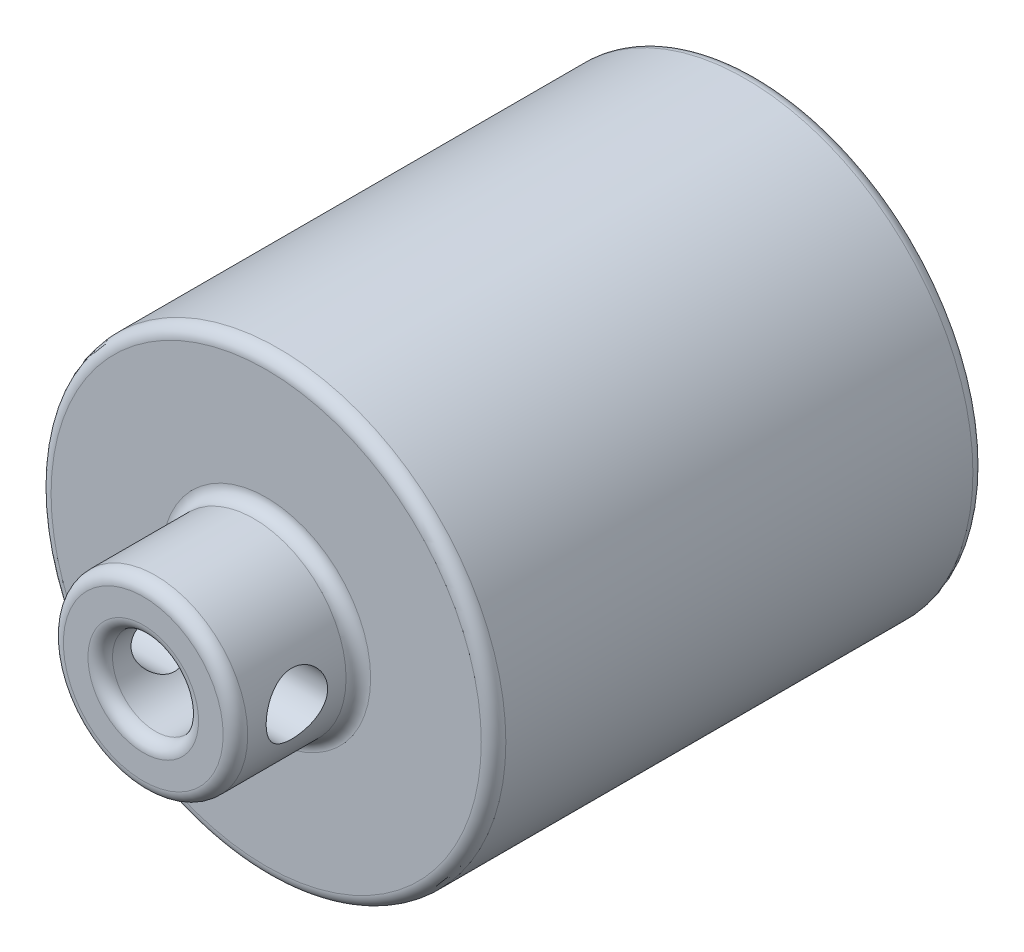
from build123d import *

# Parameters (mm, degrees)
SKETCH1_R           = 18.5
BOSS_EXTRUDE1_DEPTH = 40
SKETCH2_R           = 7.5
BOSS_EXTRUDE2_DEPTH = 10
SKETCH3_R           = 3.5
CUT_EXTRUDE1_DEPTH  = 32
FILLET1_R           = 1
FILLET2_R           = 1
FILLET3_R           = 1
FILLET4_R           = 1
FILLET6_R           = 1
SKETCH4_R           = 2.5
CUT_EXTRUDE2_DEPTH  = 141


with BuildPart() as part:
    # Sketch1 → Boss-Extrude1 (new body)
    with BuildSketch(Plane.XY):
        Circle(SKETCH1_R)
    extrude(amount=BOSS_EXTRUDE1_DEPTH)

    # Sketch2 → Boss-Extrude2 (add)
    with BuildSketch(Plane.XY.offset(40)):
        Circle(SKETCH2_R)
    extrude(amount=BOSS_EXTRUDE2_DEPTH)

    # Sketch3 → Cut-Extrude1 (cut)
    with BuildSketch(Plane.XY.offset(50)):
        Circle(SKETCH3_R)
    extrude(amount=-CUT_EXTRUDE1_DEPTH, mode=Mode.SUBTRACT)

    # Fillet1
    fillet1_edges = [part.edges().sort_by_distance(p)[0] for p in [
        (-7.5, 0, 50),
    ]]
    fillet(fillet1_edges, radius=FILLET1_R)

    # Fillet2
    fillet2_edges = [part.edges().sort_by_distance(p)[0] for p in [
        (-18.5, 0, 40),
    ]]
    fillet(fillet2_edges, radius=FILLET2_R)

    # Fillet3
    fillet3_edges = [part.edges().sort_by_distance(p)[0] for p in [
        (-7.5, 0, 40),
    ]]
    fillet(fillet3_edges, radius=FILLET3_R)

    # Fillet4
    fillet4_edges = [part.edges().sort_by_distance(p)[0] for p in [
        (-18.5, 0, 0),
    ]]
    fillet(fillet4_edges, radius=FILLET4_R)

    # Fillet6
    fillet6_edges = [part.edges().sort_by_distance(p)[0] for p in [
        (-3.5, 0, 50),
    ]]
    fillet(fillet6_edges, radius=FILLET6_R)

    # Sketch4 → Cut-Extrude2 (cut, symmetric)
    with BuildSketch(Plane(origin=(0, 0, 0), x_dir=(0, 0, -1), z_dir=(1, 0, 0))):
        with Locations((-45, 0)):
            Circle(SKETCH4_R)
    extrude(amount=CUT_EXTRUDE2_DEPTH, both=True, mode=Mode.SUBTRACT)


solid = part.part
